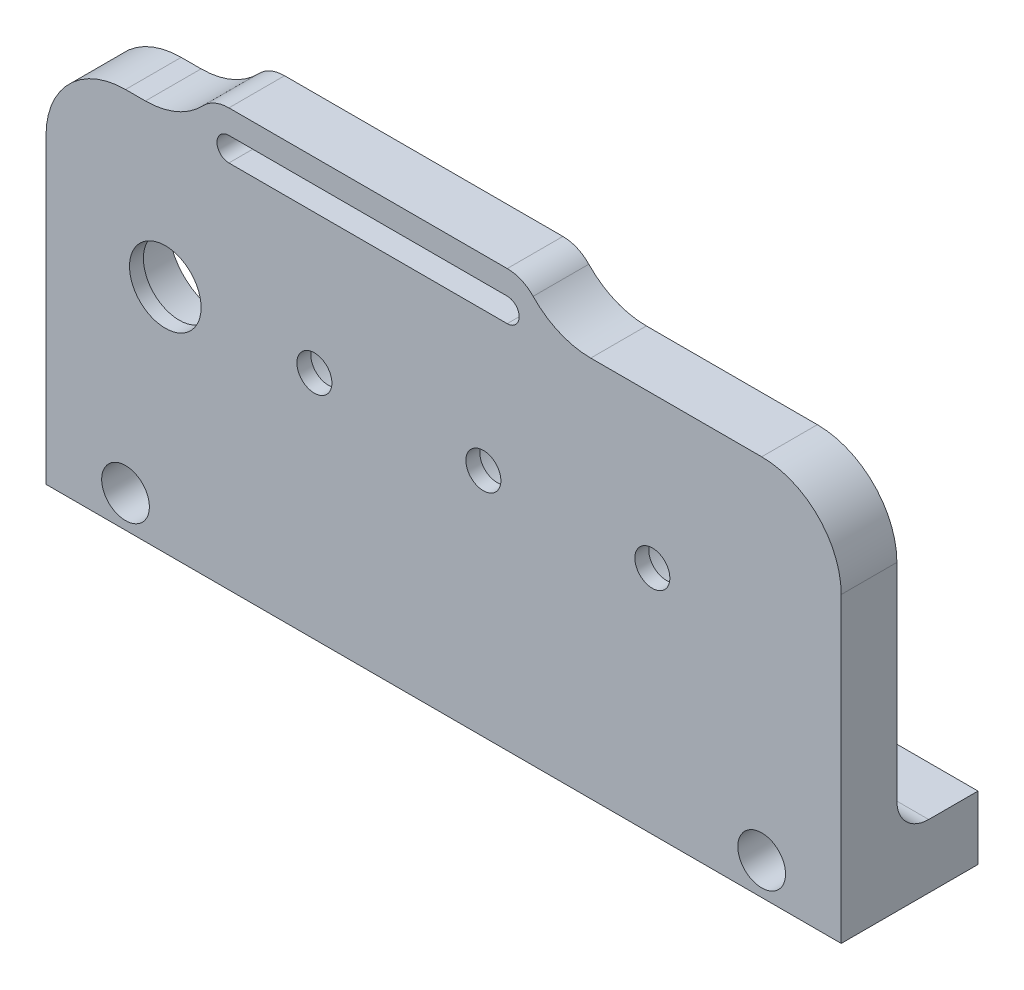
from build123d import *

# Parameters (mm, degrees)
SKETCH1_W           = 100
SKETCH1_H           = 48
BOSS_EXTRUDE1_DEPTH = 7
CUT_EXTRUDE1_REACH  = 113.144
SKETCH2_R           = 4.5
SKETCH2_R_2         = 2.2
SKETCH3_W           = 100
SKETCH3_H           = 8
BOSS_EXTRUDE2_DEPTH = 10.2
SKETCH4_R           = 6.6
CUT_EXTRUDE2_DEPTH  = 5.25
SKETCH5_R           = 2.6
CUT_EXTRUDE3_DEPTH  = 7
SKETCH7_R           = 1.5
CUT_EXTRUDE4_DEPTH  = 112.391382072
CUT_EXTRUDE5_REACH  = 114.249
SKETCH8_R           = 1.7
SKETCH9_R           = 3
CUT_EXTRUDE6_DEPTH  = 9
BOSS_EXTRUDE3_DEPTH = 7
CUT_EXTRUDE7_REACH  = 116.246
FILLET1_R           = 10
FILLET2_R           = 10
SKETCH12_R          = 2.6
BOSS_EXTRUDE6_DEPTH = 17.2
FILLET3_R           = 4


with BuildPart() as part:
    # Sketch1 → Boss-Extrude1 (new body)
    with BuildSketch(Plane.XY):
        with Locations((50, 24)):
            Rectangle(SKETCH1_W, SKETCH1_H)
    extrude(amount=BOSS_EXTRUDE1_DEPTH)

    # Sketch2 → Cut-Extrude1 (cut, up to next)
    with BuildSketch(Plane.XY.offset(7), mode=Mode.PRIVATE) as cut_extrude1_sk1:
        with Locations((15, 29)):
            Circle(SKETCH2_R)
    cut_extrude1_tool1 = extrude(cut_extrude1_sk1.sketch, amount=-CUT_EXTRUDE1_REACH, mode=Mode.PRIVATE) & part.part
    # Sketch2 → Cut-Extrude1 (cut, up to next)
    with BuildSketch(Plane.XY.offset(7), mode=Mode.PRIVATE) as cut_extrude1_sk2:
        with Locations((33.75, 29)):
            Circle(SKETCH2_R_2)
    cut_extrude1_tool2 = extrude(cut_extrude1_sk2.sketch, amount=-CUT_EXTRUDE1_REACH, mode=Mode.PRIVATE) & part.part
    # Sketch2 → Cut-Extrude1 (cut, up to next)
    with BuildSketch(Plane.XY.offset(7), mode=Mode.PRIVATE) as cut_extrude1_sk3:
        with Locations((55, 29)):
            Circle(SKETCH2_R_2)
    cut_extrude1_tool3 = extrude(cut_extrude1_sk3.sketch, amount=-CUT_EXTRUDE1_REACH, mode=Mode.PRIVATE) & part.part
    # Sketch2 → Cut-Extrude1 (cut, up to next)
    with BuildSketch(Plane.XY.offset(7), mode=Mode.PRIVATE) as cut_extrude1_sk4:
        with Locations((76.25, 29)):
            Circle(SKETCH2_R_2)
    cut_extrude1_tool4 = extrude(cut_extrude1_sk4.sketch, amount=-CUT_EXTRUDE1_REACH, mode=Mode.PRIVATE) & part.part
    add(cut_extrude1_tool1.solids().sort_by_distance((15, 29, 7))[0], mode=Mode.SUBTRACT)
    add(cut_extrude1_tool2.solids().sort_by_distance((33.75, 29, 7))[0], mode=Mode.SUBTRACT)
    add(cut_extrude1_tool3.solids().sort_by_distance((55, 29, 7))[0], mode=Mode.SUBTRACT)
    add(cut_extrude1_tool4.solids().sort_by_distance((76.25, 29, 7))[0], mode=Mode.SUBTRACT)

    # Sketch3 → Boss-Extrude2 (add)
    with BuildSketch(Plane(origin=(0, 0, 0), x_dir=(-1, 0, 0), z_dir=(0, 0, -1))):
        with Locations((-50, 4)):
            Rectangle(SKETCH3_W, SKETCH3_H)
    extrude(amount=BOSS_EXTRUDE2_DEPTH)

    # Sketch4 → Cut-Extrude2 (cut)
    with BuildSketch(Plane(origin=(0, 0, 0), x_dir=(-1, 0, 0), z_dir=(0, 0, -1))):
        with Locations((-76.25, 29)):
            Circle(SKETCH4_R)
        with Locations((-55, 29)):
            Circle(SKETCH4_R)
        with Locations((-33.75, 29)):
            Circle(SKETCH4_R)
        with Locations((-15, 29)):
            Circle(SKETCH4_R)
    extrude(amount=-CUT_EXTRUDE2_DEPTH, mode=Mode.SUBTRACT)

    # Sketch5 → Cut-Extrude3 (cut)
    with BuildSketch(Plane.XY.offset(7)):
        with Locations((35.000022648, 4.052132501)):
            Circle(SKETCH5_R)
        with Locations((64.999977352, 4)):
            Circle(SKETCH5_R)
    extrude(amount=-CUT_EXTRUDE3_DEPTH, mode=Mode.SUBTRACT)

    # Sketch7 → Cut-Extrude4 (cut, through all)
    with BuildSketch(Plane.XY):
        with Locations((35.000022648, 4.052132501)):
            Circle(SKETCH7_R)
        with Locations((64.999977352, 4)):
            Circle(SKETCH7_R)
    extrude(amount=-CUT_EXTRUDE4_DEPTH, mode=Mode.SUBTRACT)

    # Sketch8 → Cut-Extrude5 (cut, up to next)
    with BuildSketch(Plane.XY.offset(7), mode=Mode.PRIVATE) as cut_extrude5_sk1:
        with Locations((10, 4.052132501)):
            Circle(SKETCH8_R)
    cut_extrude5_tool1 = extrude(cut_extrude5_sk1.sketch, amount=-CUT_EXTRUDE5_REACH, mode=Mode.PRIVATE) & part.part
    # Sketch8 → Cut-Extrude5 (cut, up to next)
    with BuildSketch(Plane.XY.offset(7), mode=Mode.PRIVATE) as cut_extrude5_sk2:
        with Locations((90, 4.052132501)):
            Circle(SKETCH8_R)
    cut_extrude5_tool2 = extrude(cut_extrude5_sk2.sketch, amount=-CUT_EXTRUDE5_REACH, mode=Mode.PRIVATE) & part.part
    add(cut_extrude5_tool1.solids().sort_by_distance((10, 4.052133, 7))[0], mode=Mode.SUBTRACT)
    add(cut_extrude5_tool2.solids().sort_by_distance((90, 4.052133, 7))[0], mode=Mode.SUBTRACT)

    # Sketch9 → Cut-Extrude6 (cut)
    with BuildSketch(Plane.XY.offset(7)):
        with Locations((10, 4.052132501)):
            Circle(SKETCH9_R)
        with Locations((90, 4.052132501)):
            Circle(SKETCH9_R)
    extrude(amount=-CUT_EXTRUDE6_DEPTH, mode=Mode.SUBTRACT)

    # Sketch10 → Boss-Extrude3 (add)
    with BuildSketch(Plane.XY.offset(7)):
        with BuildLine():
            Line((23, 52.5), (58, 52.5))
            ThreePointArc((58, 52.5), (62.5, 48), (58, 43.5))
            Line((58, 43.5), (23, 43.5))
            ThreePointArc((23, 43.5), (18.5, 48), (23, 52.5))
        make_face()
        with BuildLine():
            Line((23, 49.5), (58, 49.5))
            ThreePointArc((58, 49.5), (59.5, 48), (58, 46.5))
            Line((58, 46.5), (23, 46.5))
            ThreePointArc((23, 46.5), (21.5, 48), (23, 49.5))
        make_face(mode=Mode.SUBTRACT)
    extrude(amount=-BOSS_EXTRUDE3_DEPTH)

    # Sketch11 → Cut-Extrude7 (cut, up to next)
    with BuildSketch(Plane.XY.offset(7), mode=Mode.PRIVATE) as cut_extrude7_sk1:
        with BuildLine():
            Line((23, 49.5), (58, 49.5))
            ThreePointArc((58, 49.5), (59.5, 48), (58, 46.5))
            Line((58, 46.5), (23, 46.5))
            ThreePointArc((23, 46.5), (21.5, 48), (23, 49.5))
        make_face()
    cut_extrude7_tool1 = extrude(cut_extrude7_sk1.sketch, amount=-CUT_EXTRUDE7_REACH, mode=Mode.PRIVATE) & part.part
    add(cut_extrude7_tool1.solids().sort_by_distance((40.5, 48, 7))[0], mode=Mode.SUBTRACT)

    # Fillet1
    fillet1_edges = [part.edges().sort_by_distance(p)[0] for p in [
        (0, 48, 3.5),
        (100, 48, 3.5),
    ]]
    fillet(fillet1_edges, radius=FILLET1_R)

    # Fillet2
    fillet2_edges = [part.edges().sort_by_distance(p)[0] for p in [
        (18.5, 48, 3.5),
        (62.5, 48, 3.5),
    ]]
    fillet(fillet2_edges, radius=FILLET2_R)

    # Sketch12 → Boss-Extrude6 (add)
    with BuildSketch(Plane.XY.offset(7)):
        with Locations((35.000022648, 4.052132501)):
            Circle(SKETCH12_R)
        with Locations((64.999977352, 4)):
            Circle(SKETCH12_R)
    extrude(amount=-BOSS_EXTRUDE6_DEPTH)

    # Fillet3
    fillet3_edges = [part.edges().sort_by_distance(p)[0] for p in [
        (50, 8, 0),
    ]]
    fillet(fillet3_edges, radius=FILLET3_R)


solid = part.part
